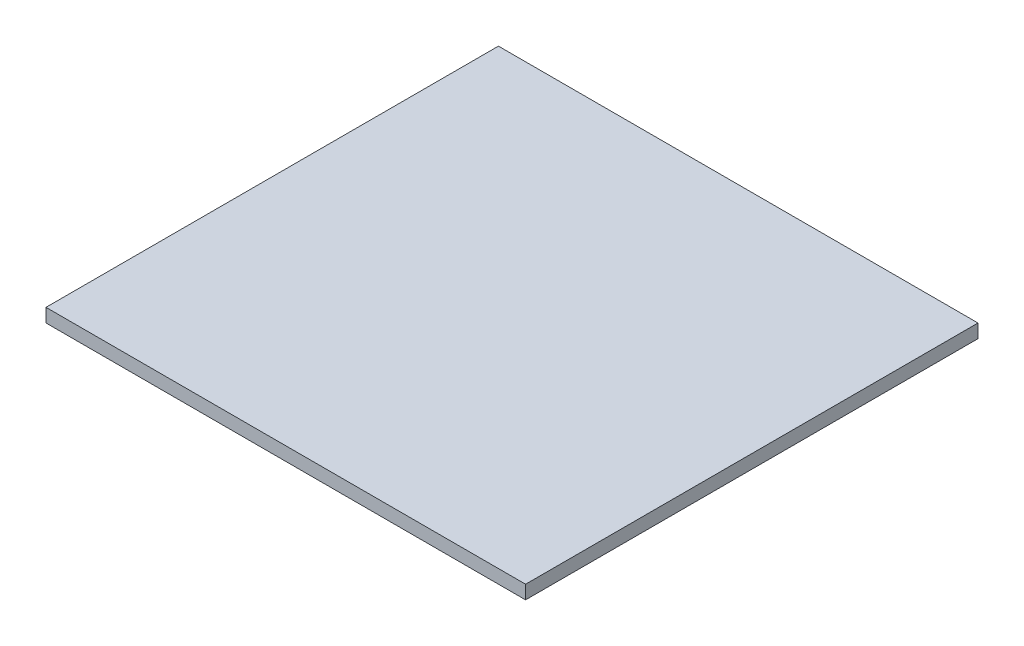
from build123d import *

# Parameters (mm, degrees)
SKETCH1_W           = 159
SKETCH1_H           = 150
BOSS_EXTRUDE1_DEPTH = 4.5


with BuildPart() as part:
    # Sketch1 → Boss-Extrude1 (new body)
    with BuildSketch(Plane(origin=(0, 0, 0), x_dir=(1, 0, 0), z_dir=(0, 1, 0))):
        Rectangle(SKETCH1_W, SKETCH1_H)
    extrude(amount=BOSS_EXTRUDE1_DEPTH)


solid = part.part
